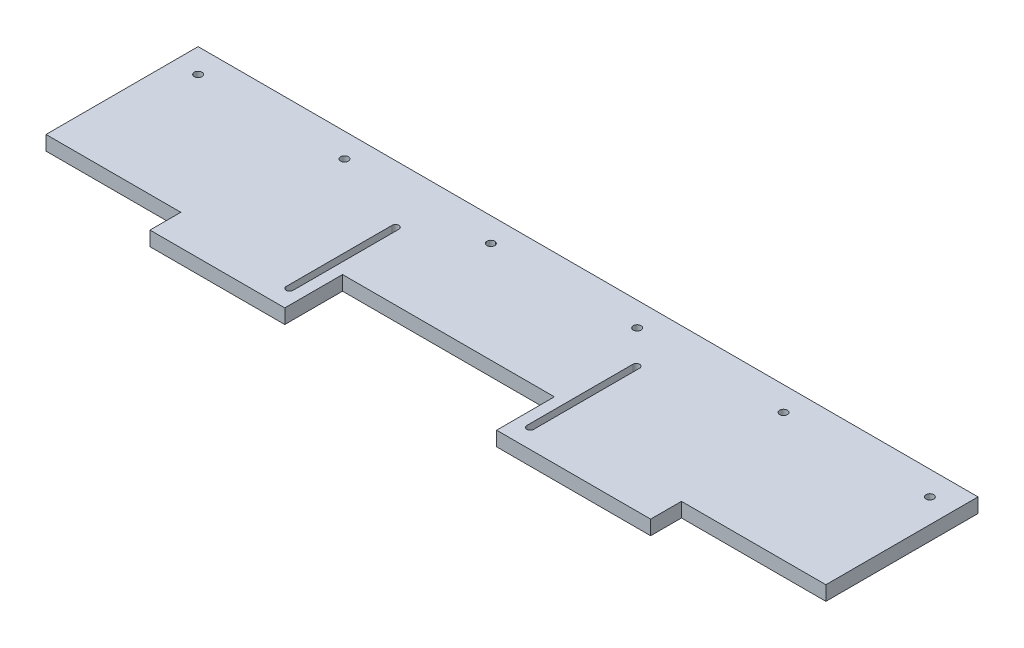
from build123d import *

# Parameters (mm, degrees)
SKETCH1_W              = 501.65
SKETCH1_H              = 57.15
BOSS_EXTRUDE1_DEPTH    = 4.7625
BOSS_EXTRUDE2_DEPTH    = 4.7625
SKETCH23_W             = 100.33
SKETCH23_H             = 9.525
BOSS_EXTRUDE3_DEPTH    = 6.35
F_10_CLEARANCE_HOLE2_D = 5.1054
LPATTERN1_COUNT        = 6
LPATTERN1_PITCH        = 96.52
CUT_EXTRUDE6_REACH     = 275.327


with BuildPart() as part:
    # Sketch1 → Boss-Extrude1 (new, symmetric)
    with BuildSketch(Plane(origin=(0, 0, 0), x_dir=(1, 0, 0), z_dir=(0, 1, 0))):
        Rectangle(SKETCH1_W, SKETCH1_H)
    extrude(amount=BOSS_EXTRUDE1_DEPTH, both=True)

    # Sketch2 → Boss-Extrude2 (add, symmetric)
    with BuildSketch(Plane(origin=(0, 0, 0), x_dir=(1, 0, 0), z_dir=(0, 1, 0))):
        Polygon((161.925, -92.075), (161.925, -71.755), (250.825, -71.755), (250.825, -28.575), (-250.825, -28.575), (-250.825, -71.755), (-168.275, -71.755), (-168.275, -92.075), (-79.375, -92.075), (-79.375, -53.975), (60.325, -53.975), (60.325, -92.075), align=None)
    extrude(amount=BOSS_EXTRUDE2_DEPTH, both=True)

    # Sketch23 → Boss-Extrude3 (add)
    with BuildSketch(Plane.ZY.offset(250.825)):
        with Locations((21.59, 0)):
            Rectangle(SKETCH23_W, SKETCH23_H)
    boss_extrude3 = extrude(amount=BOSS_EXTRUDE3_DEPTH)

    # Mirror1: Boss-Extrude3 across plane
    add(boss_extrude3.mirror(Plane(origin=(0, 0, 0), x_dir=(0, 0, 1), z_dir=(1, 0, 0))))

    # #10 Clearance Hole2 (through all)
    with Locations(Plane(origin=(0, 4.7625, 0), x_dir=(1, 0, 0), z_dir=(0, 1, 0))):
        with Locations((241.3, 12.7)):
            f_10_clearance_hole2 = Hole(F_10_CLEARANCE_HOLE2_D / 2)

    # LPattern1: #10 Clearance Hole2 ×6
    with Locations(*[(-i * LPATTERN1_PITCH, 0, 0) for i in range(1, LPATTERN1_COUNT)]):
        add(f_10_clearance_hole2, mode=Mode.SUBTRACT)

    # Sketch40 → Cut-Extrude6 (cut, up to next)
    with BuildSketch(Plane(origin=(0, 4.7625, 0), x_dir=(1, 0, 0), z_dir=(0, 1, 0)), mode=Mode.PRIVATE) as cut_extrude6_sk1:
        with BuildLine():
            Line((-91.1479, -79.375), (-91.1479, -9.525))
            ThreePointArc((-91.1479, -9.525), (-88.9, -7.2771), (-86.6521, -9.525))
            Line((-86.6521, -9.525), (-86.6521, -79.375))
            ThreePointArc((-86.6521, -79.375), (-88.9, -81.6229), (-91.1479, -79.375))
        make_face()
    cut_extrude6_tool1 = extrude(cut_extrude6_sk1.sketch, amount=-CUT_EXTRUDE6_REACH, mode=Mode.PRIVATE) & part.part
    # Sketch40 → Cut-Extrude6 (cut, up to next)
    with BuildSketch(Plane(origin=(0, 4.7625, 0), x_dir=(1, 0, 0), z_dir=(0, 1, 0)), mode=Mode.PRIVATE) as cut_extrude6_sk2:
        with BuildLine():
            Line((67.6021, -79.375), (67.6021, -9.525))
            ThreePointArc((67.6021, -9.525), (69.85, -7.2771), (72.0979, -9.525))
            Line((72.0979, -9.525), (72.0979, -79.375))
            ThreePointArc((72.0979, -79.375), (69.85, -81.6229), (67.6021, -79.375))
        make_face()
    cut_extrude6_tool2 = extrude(cut_extrude6_sk2.sketch, amount=-CUT_EXTRUDE6_REACH, mode=Mode.PRIVATE) & part.part
    add(cut_extrude6_tool1.solids().sort_by_distance((-88.9, 4.7625, 44.45))[0], mode=Mode.SUBTRACT)
    add(cut_extrude6_tool2.solids().sort_by_distance((69.85, 4.7625, 44.45))[0], mode=Mode.SUBTRACT)


solid = part.part
